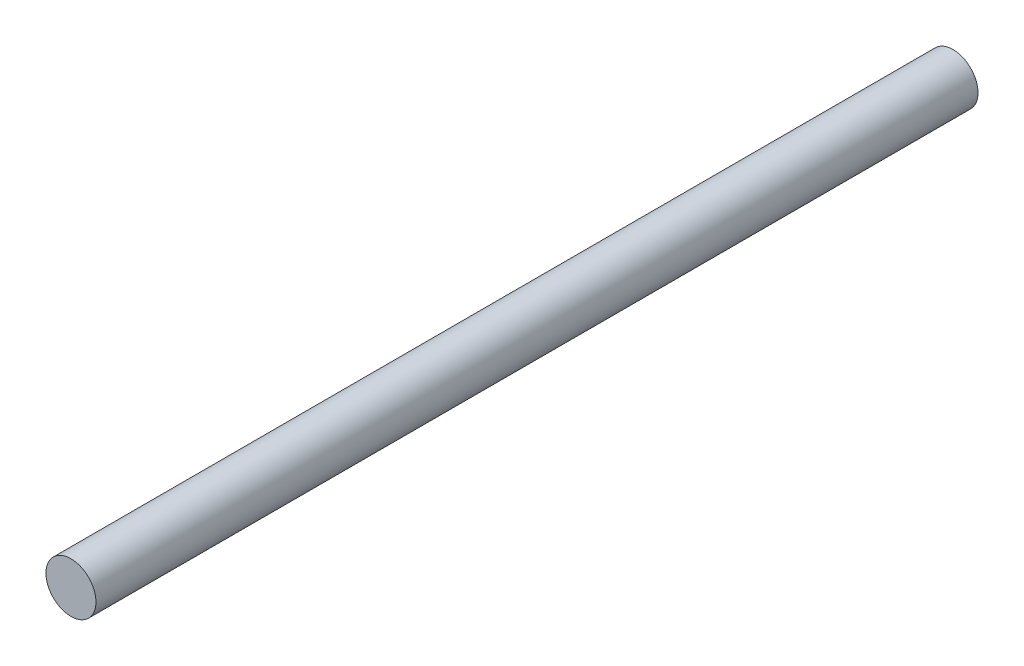
from build123d import *

# Parameters (mm, degrees)
SKETCH_1_R             = 2.5
EXTRUDE_1_DEPTH        = 88.2
SKETCH_2_R             = 12.5
EXTRUDE_2_DEPTH        = 62
SKETCH_3_W             = 40
SKETCH_3_H             = 17.730441408
SKETCH_3_R             = 5
EXTRUDE_3_DEPTH        = 3
PATTERN_LINEAR_1_COUNT = 2
PATTERN_LINEAR_1_PITCH = 59
SKETCH_5_R             = 2.5
CUT_EXTRUDE_1_DEPTH    = 98.649833589


with BuildPart() as part:
    # 草图1 → 凸台-拉伸1 (new body)
    with BuildSketch(Plane.XY):
        Circle(SKETCH_1_R)
    extrude(amount=EXTRUDE_1_DEPTH)

    # 草图2 → 凸台-拉伸2 (add)
    with BuildSketch(Plane.XY.offset(73.2)):
        Circle(SKETCH_2_R)
    extrude(amount=-EXTRUDE_2_DEPTH)

    # 草图3 → 凸台-拉伸3 (add)
    with BuildSketch(Plane.XY.offset(73.2)):
        with Locations((20, 0)):
            Rectangle(SKETCH_3_W, SKETCH_3_H)
        with Locations((32.640039451, 0)):
            Circle(SKETCH_3_R, mode=Mode.SUBTRACT)
    extrude_3 = extrude(amount=-EXTRUDE_3_DEPTH)

    # 阵列(线性)1: 凸台-拉伸3 ×2
    with Locations(*[(0, 0, -i * PATTERN_LINEAR_1_PITCH) for i in range(1, PATTERN_LINEAR_1_COUNT)]):
        add(extrude_3)

    # 草图5 → 切除-拉伸1 (cut, through all)
    with BuildSketch(Plane.XY.offset(88.2)):
        with BuildLine():
            Line((8.812369821, 8.865220704), (40, 8.865220704))
            Line((40, 8.865220704), (40, -8.865220704))
            Line((40, -8.865220704), (8.812369821, -8.865220704))
            ThreePointArc((8.812369821, -8.865220704), (-12.5, 0), (8.812369821, 8.865220704))
        make_face()
        Circle(SKETCH_5_R, mode=Mode.SUBTRACT)
    extrude(amount=-CUT_EXTRUDE_1_DEPTH, mode=Mode.SUBTRACT)


solid = part.part
